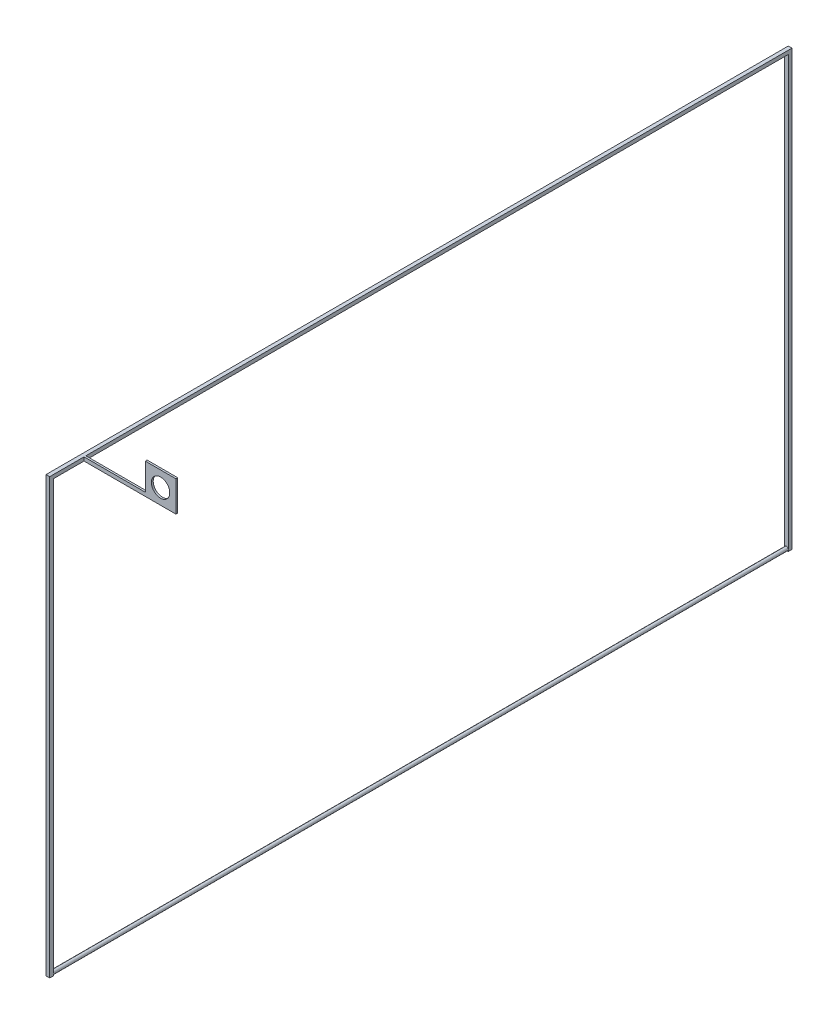
from build123d import *

# Parameters (mm, degrees)
SKETCH2_R                = 1.5
BOSS_EXTRUDE1_DEPTH      = 600
BOSS_EXTRUDE2_DEPTH      = 1.5
BOSS_EXTRUDE2_DEPTH_BACK = 1.5
SKETCH3_R                = 7.5
BOSS_EXTRUDE3_DEPTH      = 1.5


with BuildPart() as part:
    # Sketch2 → Boss-Extrude1 (new body)
    with BuildSketch(Plane(origin=(0, 0, -600), x_dir=(-1, 0, 0), z_dir=(0, 0, -1))):
        Circle(SKETCH2_R)
    extrude(amount=-BOSS_EXTRUDE1_DEPTH)

    # Sketch1 → Boss-Extrude2 (add, two sides: drawn at the far end of the back side and taken through both)
    with BuildSketch(Plane(origin=(0, 0, 0), x_dir=(0, 0, -1), z_dir=(1, 0, 0)).offset(-BOSS_EXTRUDE2_DEPTH_BACK)):
        Polygon((0, 0), (0, -1.5), (-3, -1.5), (-3, 353), (603, 353), (603, -1.5), (600, -1.5), (600, 0), (600, 350), (0, 350), align=None)
    extrude(amount=BOSS_EXTRUDE2_DEPTH + BOSS_EXTRUDE2_DEPTH_BACK)

    # Sketch3 → Boss-Extrude3 (add)
    with BuildSketch(Plane(origin=(0, 0, -25), x_dir=(-1, 0, 0), z_dir=(0, 0, -1))):
        Polygon((-1.5, 350), (-1.5, 353), (-51.5, 353), (-51.5, 375), (-76.5, 375), (-76.5, 350), align=None)
        with Locations((-64, 362.5)):
            Circle(SKETCH3_R, mode=Mode.SUBTRACT)
    extrude(amount=BOSS_EXTRUDE3_DEPTH)


solid = part.part
